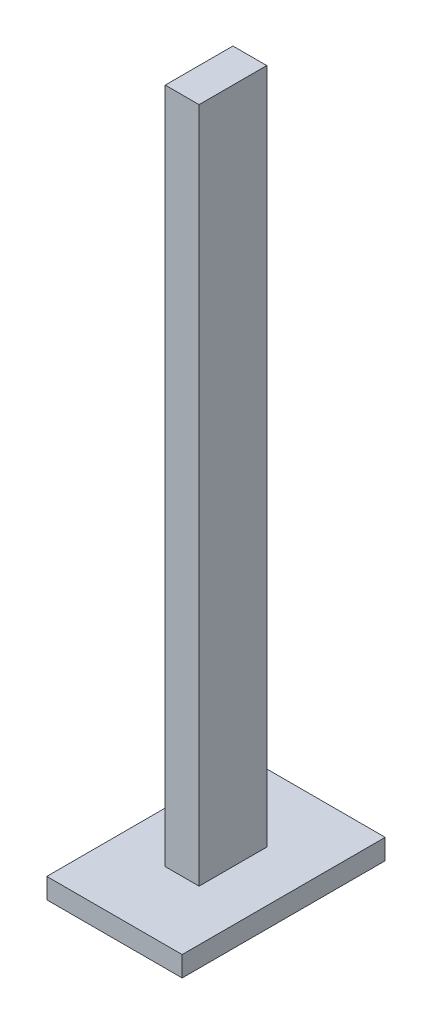
from build123d import *

# Parameters (mm, degrees)
SKETCH1_W           = 50.8
SKETCH1_H           = 76.2
BOSS_EXTRUDE1_DEPTH = 7.62
SKETCH2_W           = 12.7
SKETCH2_H           = 25.4
BOSS_EXTRUDE2_DEPTH = 254


with BuildPart() as part:
    # Sketch1 → Boss-Extrude1 (new body)
    with BuildSketch(Plane(origin=(0, 0, 0), x_dir=(1, 0, 0), z_dir=(0, 1, 0))):
        Rectangle(SKETCH1_W, SKETCH1_H)
    extrude(amount=BOSS_EXTRUDE1_DEPTH)

    # Sketch2 → Boss-Extrude2 (add)
    with BuildSketch(Plane(origin=(0, 7.62, 0), x_dir=(1, 0, 0), z_dir=(0, 1, 0))):
        Rectangle(SKETCH2_W, SKETCH2_H)
    extrude(amount=BOSS_EXTRUDE2_DEPTH)


solid = part.part
